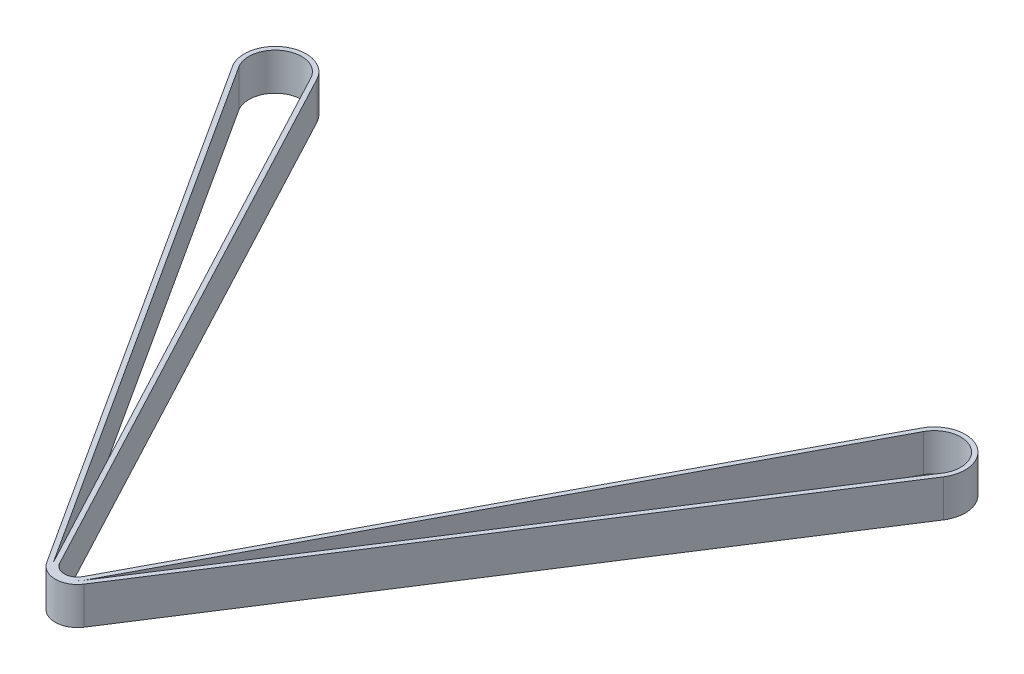
from build123d import *

# Parameters (mm, degrees)
BOSS_EXTRUDE1_DEPTH = 2.835


with BuildPart() as part:
    # Sketch1 → Boss-Extrude1 (new, symmetric)
    with BuildSketch(Plane(origin=(0, 0, 0), x_dir=(1, 0, 0), z_dir=(0, 1, 0))):
        with BuildLine():
            Line((-2.841942613, -81.831535745), (-53.942239235, -2.540639647))
            ThreePointArc((-53.942239235, -2.540639647), (-52.37115576, 4.046445399), (-45.856630335, 2.197404791))
            Line((-45.856630335, 2.197404791), (-1.76689538, -80.937059612))
            ThreePointArc((-1.76689538, -80.937059612), (0, -82), (1.76689538, -80.937059612))
            Line((1.76689538, -80.937059612), (45.856630335, 2.197404791))
            ThreePointArc((45.856630335, 2.197404791), (52.37115576, 4.046445399), (53.942239235, -2.540639647))
            Line((53.942239235, -2.540639647), (2.841942613, -81.831535745))
            ThreePointArc((2.841942613, -81.831535745), (0, -83.381), (-2.841942613, -81.831535745))
        make_face()
        with BuildLine():
            Line((-2.261954324, -81.45775294), (-53.362250947, -2.166856842))
            ThreePointArc((-53.362250947, -2.166856842), (-52.022307684, 3.45112614), (-46.466209241, 1.874119225))
            Line((-46.466209241, 1.874119225), (-2.376474286, -81.260345179))
            ThreePointArc((-2.376474286, -81.260345179), (0, -82.69), (2.376474286, -81.260345179))
            Line((2.376474286, -81.260345179), (46.466209241, 1.874119225))
            ThreePointArc((46.466209241, 1.874119225), (52.022307684, 3.45112614), (53.362250947, -2.166856842))
            Line((53.362250947, -2.166856842), (2.261954324, -81.45775294))
            ThreePointArc((2.261954324, -81.45775294), (0, -82.691), (-2.261954324, -81.45775294))
        make_face(mode=Mode.SUBTRACT)
    extrude(amount=BOSS_EXTRUDE1_DEPTH, both=True)


solid = part.part
